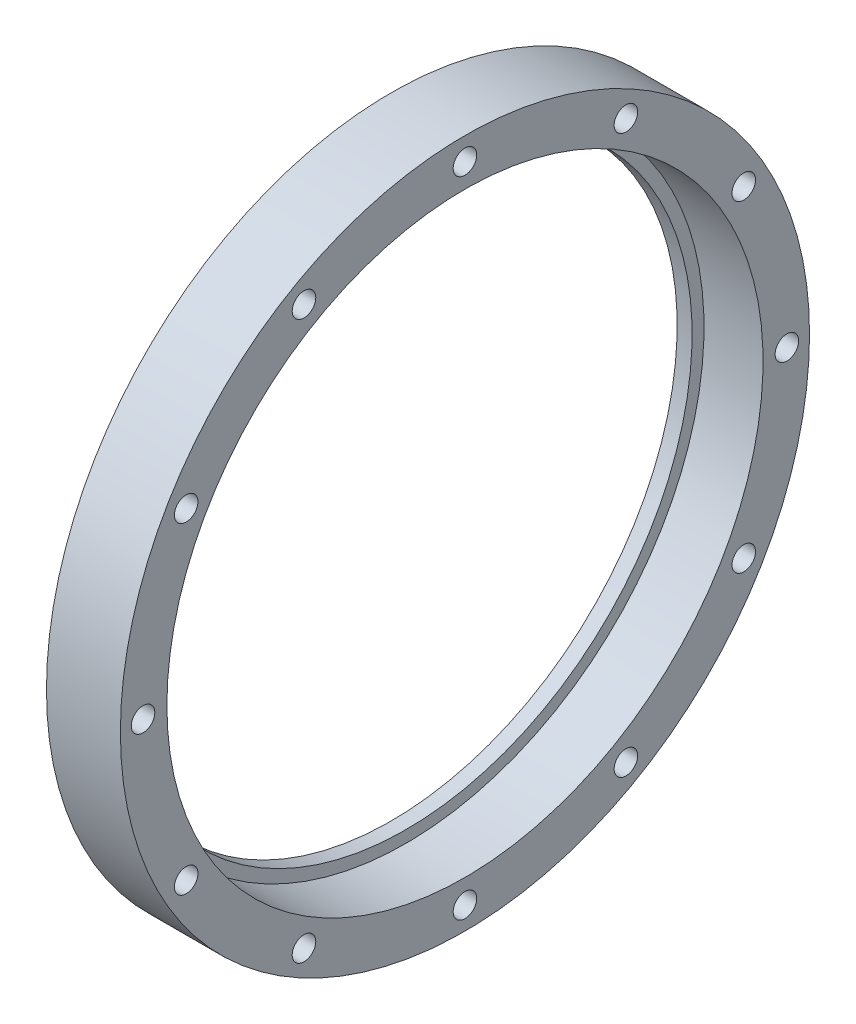
from build123d import *

# Parameters (mm, degrees)
HOLE_WIZARD_M3_1_D       = 2.5
PATTERN_CIRCULAR_1_COUNT = 12


with BuildPart() as part:
    # 草图1 → 旋转1 (revolve)
    with BuildSketch(Plane.XY):
        Polygon((0, 57.8), (0, 48), (2.5, 48), (2.5, 50), (12.4, 50), (12.4, 57.8), align=None)
    revolve(axis=Axis((0, 0, 0), (1, 0, 0)))

    # M3 螺纹孔1 (through all)
    with Locations(Plane(origin=(12.4, 0, 0), x_dir=(0, 0, -1), z_dir=(1, 0, 0))):
        with Locations((0, 54)):
            hole_wizard_m3_1 = Hole(HOLE_WIZARD_M3_1_D / 2)

    # 草图9 → Ø4.0mm 暗销孔1 (revolve, cut)
    with BuildSketch(Plane(origin=(12.4, 54, 0), x_dir=(0, 0, -1), z_dir=(0, 1, 0))):
        Polygon((0, 0), (0, 5.186699723), (1.975, 4), (1.975, 0), align=None)
    f_4_0mm_1 = revolve(axis=Axis((18.75, 54, 0), (-1, 0, 0)), mode=Mode.SUBTRACT)

    # 阵列(圆周)1: M3 螺纹孔1, Ø4.0mm 暗销孔1 ×12 about axis
    pattern_circular_1_axis = Axis((0, 0, 0), (-1, 0, 0))
    add([hole_wizard_m3_1.rotate(pattern_circular_1_axis, i * 360 / PATTERN_CIRCULAR_1_COUNT) for i in range(1, PATTERN_CIRCULAR_1_COUNT)], mode=Mode.SUBTRACT)
    add([f_4_0mm_1.rotate(pattern_circular_1_axis, i * 360 / PATTERN_CIRCULAR_1_COUNT) for i in range(1, PATTERN_CIRCULAR_1_COUNT)], mode=Mode.SUBTRACT)


solid = part.part
